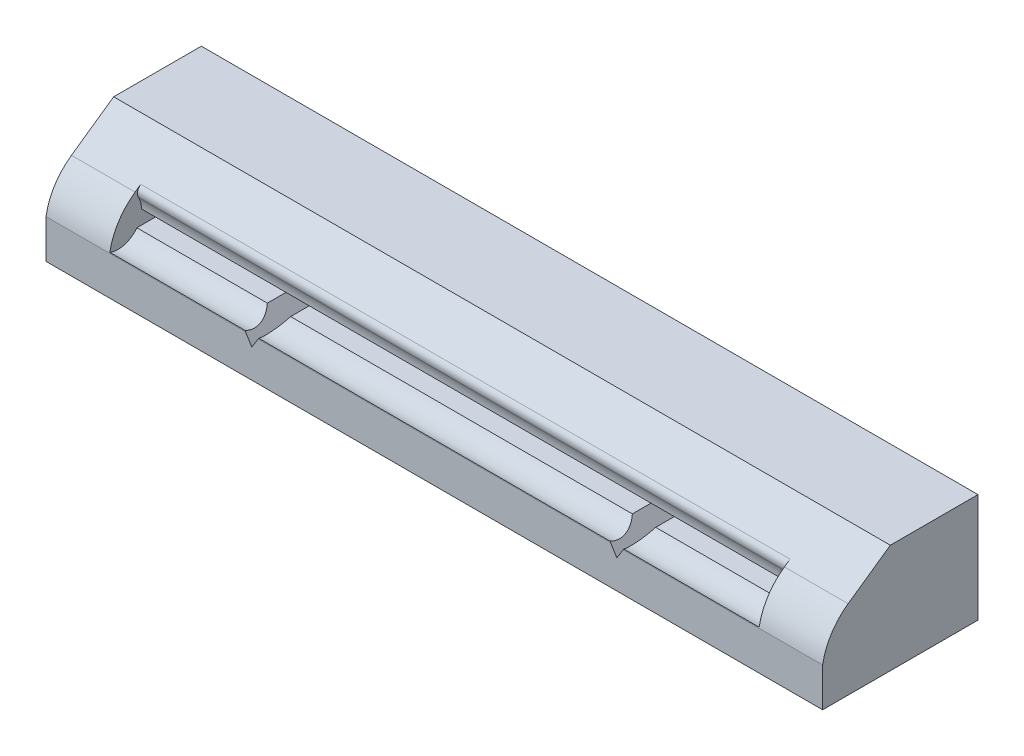
from build123d import *

# Parameters (mm, degrees)
SKETCH_1_W                         = 50
SKETCH_1_H                         = 7
EXTRUDE_1_DEPTH                    = 10
CUT_EXTRUDE_2_DEPTH                = 7.5
CHAMFER_2_SIZE                     = 0.6
CHAMFER_2_SIZE2                    = 3.402769092
CUT_EXTRUDE_1775_DEPTH             = 28.152347965
CUT_EXTRUDE_1775_DEPTH_BACK        = 28.152347965
CUT_EXTRUDE_1975_REACH             = 29.152
CUT_EXTRUDE_1975_DIRECTION_2_REACH = 29.152


with BuildPart() as part:
    # Эскиз1 → Бобышка-Вытянуть1 (new body)
    with BuildSketch(Plane(origin=(0, 66.754264805, 0), x_dir=(-1, 0, 0), z_dir=(0, 0, 1))):
        with Locations((0, 66.754264805)):
            Rectangle(SKETCH_1_W, SKETCH_1_H)
    extrude(amount=EXTRUDE_1_DEPTH)

    # Эскиз4 → Вырез-Вытянуть2 (cut)
    with BuildSketch(Plane(origin=(0, 66.754264805, 10), x_dir=(-1, 0, 0), z_dir=(0, 0, 1))):
        Polygon((-20.9, 67.204264805), (-12.5, 67.204264805), (-11.75, 68.404264805), (-11, 67.204264805), (11, 67.204264805), (11.75, 68.404264805), (12.5, 67.204264805), (20.9, 67.204264805), (20.9, 66.304264805), (-20.9, 66.304264805), align=None)
    extrude(amount=-CUT_EXTRUDE_2_DEPTH, mode=Mode.SUBTRACT)

    # Фаска2
    chamfer_2_edges = [part.edges().sort_by_distance(p)[0] for p in [
        (11.375, -1.05, 2.5),
        (-11.375, -1.05, 2.5),
        (-12.125, -1.05, 2.5),
        (12.125, -1.05, 2.5),
    ]]
    chamfer_2_side = [part.faces().sort_by_distance(p)[0] for p in [
        (0, -0.038812785, 2.5),
    ]]
    chamfer(chamfer_2_edges, length=CHAMFER_2_SIZE, length2=CHAMFER_2_SIZE2, reference=chamfer_2_side[0])

    # Эскиз5 → Cut-Extrude 1775 (cut, two sides: drawn at the far end of the back side and taken through both)
    with BuildSketch(Plane(origin=(0, 0, 0), x_dir=(0, 0, -1), z_dir=(1, 0, 0)).offset(-CUT_EXTRUDE_1775_DEPTH_BACK)):
        with BuildLine():
            Line((-10, -1), (-10, 3.5))
            Line((-10, 3.5), (-5.644148579, 3.5))
            Line((-5.644148579, 3.5), (-8.361695911, 1.597152873))
            ThreePointArc((-8.361695911, 1.597152873), (-9.442167509, 0.463418829), (-10, -1))
        make_face()
    extrude(amount=CUT_EXTRUDE_1775_DEPTH + CUT_EXTRUDE_1775_DEPTH_BACK, mode=Mode.SUBTRACT)

    # Cut-Extrude 1975: up to this face of the body (flat: up to its plane)
    cut_extrude_1975_end = Plane(part.part.faces().sort_by_distance((-20.9, -0.004333952, 6.091884202))[0])
    # Эскиз6 → Cut-Extrude 1975 (cut, up to the picked face)
    with BuildSketch(Plane(origin=(0, 0, 0), x_dir=(0, 0, -1), z_dir=(1, 0, 0)), mode=Mode.PRIVATE) as cut_extrude_1975_sk1:
        with BuildLine():
            Line((-8.00005385, 1.85037737), (-10.83265057, -0.133028206))
            ThreePointArc((-10.83265057, -0.133028206), (-8.786352952, -0.894909941), (-8.147597927, 1.193101011))
            ThreePointArc((-8.147597927, 1.193101011), (-8.201124989, 1.550315037), (-8.00005385, 1.85037737))
        make_face()
    cut_extrude_1975_tool1 = split(extrude(cut_extrude_1975_sk1.sketch, amount=-CUT_EXTRUDE_1975_REACH, mode=Mode.PRIVATE), bisect_by=cut_extrude_1975_end, keep=Keep.BOTH, mode=Mode.PRIVATE)
    add(cut_extrude_1975_tool1.solids().sort_by(Axis((0, 0.082385, 9.170045), (-1, 0, 0)))[0], mode=Mode.SUBTRACT)

    # Cut-Extrude 1975 direction 2: up to this face of the body (flat: up to its plane)
    cut_extrude_1975_direction_2_end = Plane(part.part.faces().sort_by_distance((20.9, -0.004333952, 6.091884202))[0])
    # Эскиз6 → Cut-Extrude 1975 direction 2 (cut, up to the picked face)
    with BuildSketch(Plane(origin=(0, 0, 0), x_dir=(0, 0, -1), z_dir=(1, 0, 0)), mode=Mode.PRIVATE) as cut_extrude_1975_direction_2_sk1:
        with BuildLine():
            Line((-8.00005385, 1.85037737), (-10.83265057, -0.133028206))
            ThreePointArc((-10.83265057, -0.133028206), (-8.786352952, -0.894909941), (-8.147597927, 1.193101011))
            ThreePointArc((-8.147597927, 1.193101011), (-8.201124989, 1.550315037), (-8.00005385, 1.85037737))
        make_face()
    cut_extrude_1975_direction_2_tool1 = split(extrude(cut_extrude_1975_direction_2_sk1.sketch, amount=CUT_EXTRUDE_1975_DIRECTION_2_REACH, mode=Mode.PRIVATE), bisect_by=cut_extrude_1975_direction_2_end, keep=Keep.BOTH, mode=Mode.PRIVATE)
    add(cut_extrude_1975_direction_2_tool1.solids().sort_by(Axis((0, 0.082385, 9.170045), (1, 0, 0)))[0], mode=Mode.SUBTRACT)


solid = part.part
